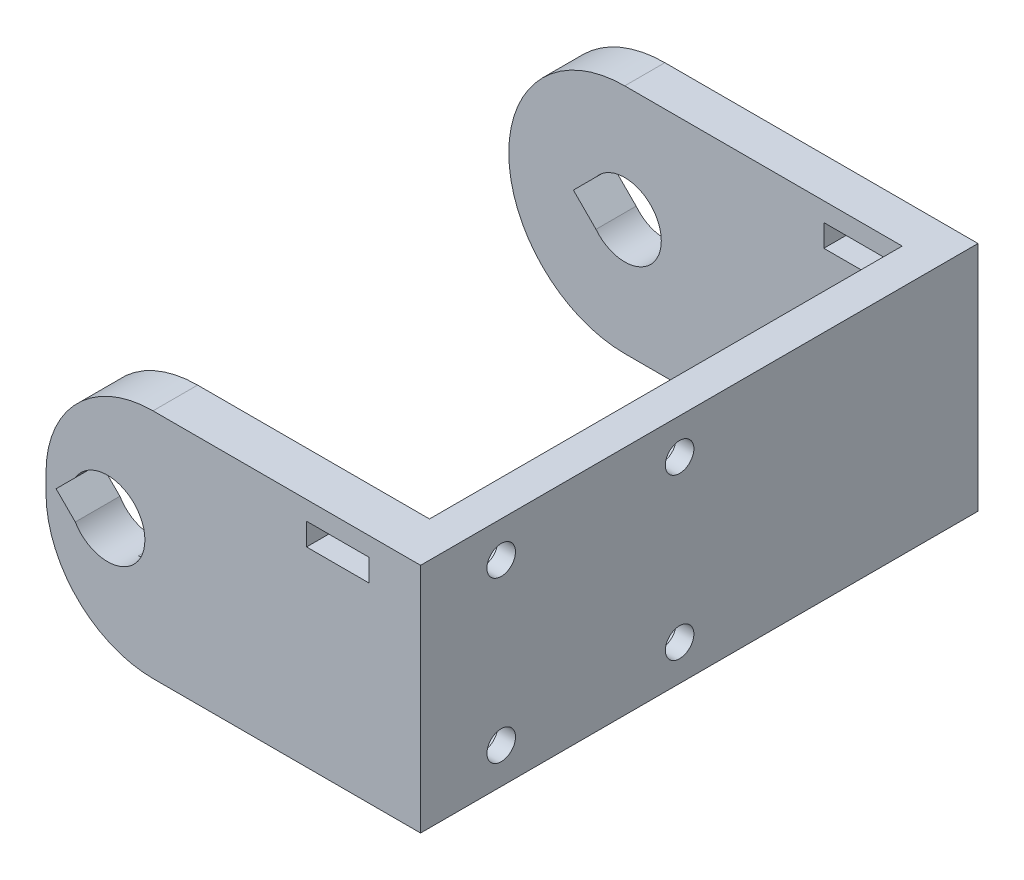
from build123d import *

# Parameters (mm, degrees)
SKETCH1_R           = 4.1
BOSS_EXTRUDE1_DEPTH = 4.5
SKETCH2_W           = 4
SKETCH2_H           = 26
BOSS_EXTRUDE2_DEPTH = 58
SKETCH3_W           = 5
SKETCH3_H           = 26
BOSS_EXTRUDE3_DEPTH = 38
CUT_EXTRUDE1_START  = -5
CUT_EXTRUDE1_DEPTH  = 3
SKETCH6_R           = 4.2
CUT_EXTRUDE2_DEPTH  = 10
FILLET1_R           = 12
CUT_EXTRUDE4_DEPTH  = 74
SKETCH8_R           = 1.599994812
SKETCH8_R_2         = 1.6
SKETCH8_R_3         = 1.599991008
CUT_EXTRUDE5_DEPTH  = 8.5
CUT_EXTRUDE6_DEPTH  = 2
SKETCH10_W          = 7
SKETCH10_H          = 2.5
CUT_EXTRUDE7_DEPTH  = 114


with BuildPart() as part:
    # Sketch1 → Boss-Extrude1 (new body)
    with BuildSketch(Plane.XY):
        with BuildLine():
            Line((58.8, 13), (93.910980652, 13))
            Line((93.910980652, 13), (93.910980652, -13))
            Line((93.910980652, -13), (58.8, -13))
            ThreePointArc((58.8, -13), (45.8, 0), (58.8, 13))
        make_face()
        with Locations((58.8, 0)):
            Circle(SKETCH1_R, mode=Mode.SUBTRACT)
    extrude(amount=BOSS_EXTRUDE1_DEPTH)

    # Sketch2 → Boss-Extrude2 (add)
    with BuildSketch(Plane.XY.offset(4.5)):
        with Locations((91.910980652, 0)):
            Rectangle(SKETCH2_W, SKETCH2_H)
    extrude(amount=BOSS_EXTRUDE2_DEPTH)

    # Sketch3 → Boss-Extrude3 (add)
    with BuildSketch(Plane.ZY.offset(-89.910980652)):
        with Locations((60, 0)):
            Rectangle(SKETCH3_W, SKETCH3_H)
    extrude(amount=BOSS_EXTRUDE3_DEPTH)

    # Sketch5 → Cut-Extrude1 (cut)
    with BuildSketch(Plane.XY.offset(62.5).offset(CUT_EXTRUDE1_START)):
        with BuildLine():
            Line((75.8, 1.8), (59.925839282, 3.994369276))
            ThreePointArc((59.925839282, 3.994369276), (54.65, 6.2252e-05), (59.925719446, -3.99440305))
            Line((59.925719446, -3.99440305), (75.8, -1.799997977))
            ThreePointArc((75.8, -1.799997977), (77.599998989, 1.011e-06), (75.8, 1.8))
        make_face()
    extrude(amount=CUT_EXTRUDE1_DEPTH, mode=Mode.SUBTRACT)

    # Sketch6 → Cut-Extrude2 (cut)
    with BuildSketch(Plane.XY.offset(62.5)):
        with Locations((58.8, 0)):
            Circle(SKETCH6_R)
    extrude(amount=-CUT_EXTRUDE2_DEPTH, mode=Mode.SUBTRACT)

    # Fillet1
    fillet1_edges = [part.edges().sort_by_distance(p)[0] for p in [
        (51.910980652, 13, 60),
        (51.910980652, -13, 60),
    ]]
    fillet(fillet1_edges, radius=FILLET1_R)

    # Sketch7 → Cut-Extrude4 (cut)
    with BuildSketch(Plane(origin=(0, 0, 0), x_dir=(-1, 0, 0), z_dir=(0, 0, -1))):
        Polygon((-56.262443614, -3.220373827), (-56.262443614, 3.220373827), (-53.042069787, 0), align=None)
    extrude(amount=-CUT_EXTRUDE4_DEPTH, mode=Mode.SUBTRACT)

    # Sketch8 → Cut-Extrude5 (cut)
    with BuildSketch(Plane(origin=(93.910980652, 0, 0), x_dir=(0, 0, -1), z_dir=(1, 0, 0))):
        with Locations((-53.458782271, -8.985219923)):
            Circle(SKETCH8_R)
        with Locations((-53.458782271, 9)):
            Circle(SKETCH8_R_2)
        with Locations((-33.458782271, 9)):
            Circle(SKETCH8_R_2)
        with Locations((-33.458782271, -8.985219923)):
            Circle(SKETCH8_R_3)
    extrude(amount=-CUT_EXTRUDE5_DEPTH, mode=Mode.SUBTRACT)

    # Sketch9 → Cut-Extrude6 (cut)
    with BuildSketch(Plane.ZY.offset(-89.910980652)):
        Polygon((30.587828745, -7.37661001), (30.630208458, -10.667233653), (33.501161984, -12.275843566), (36.329735796, -10.593829837), (36.287356083, -7.303206194), (33.416402558, -5.69459628), align=None)
        Polygon((30.584160019, 10.602044603), (30.63405982, 7.311526406), (33.508682072, 5.709481802), (36.333404522, 7.397955397), (36.283504721, 10.688473594), (33.408882469, 12.290518198), align=None)
        Polygon((50.589182836, -7.374195689), (50.62879464, -10.664853815), (53.498394075, -12.27587805), (56.328381705, -10.596244158), (56.288769901, -7.305586031), (53.419170466, -5.694561797), align=None)
        Polygon((50.692796157, 7.216934993), (53.619968806, 5.713053256), (56.38595492, 7.496118262), (56.224768384, 10.783065007), (53.297595735, 12.286946744), (50.531609621, 10.503881738), align=None)
    extrude(amount=-CUT_EXTRUDE6_DEPTH, mode=Mode.SUBTRACT)

    # Sketch10 → Cut-Extrude7 (cut)
    with BuildSketch(Plane(origin=(0, 0, 0), x_dir=(-1, 0, 0), z_dir=(0, 0, -1))):
        with Locations((-84.62488512, 9.639193317)):
            Rectangle(SKETCH10_W, SKETCH10_H)
    extrude(amount=-CUT_EXTRUDE7_DEPTH, mode=Mode.SUBTRACT)


solid = part.part
